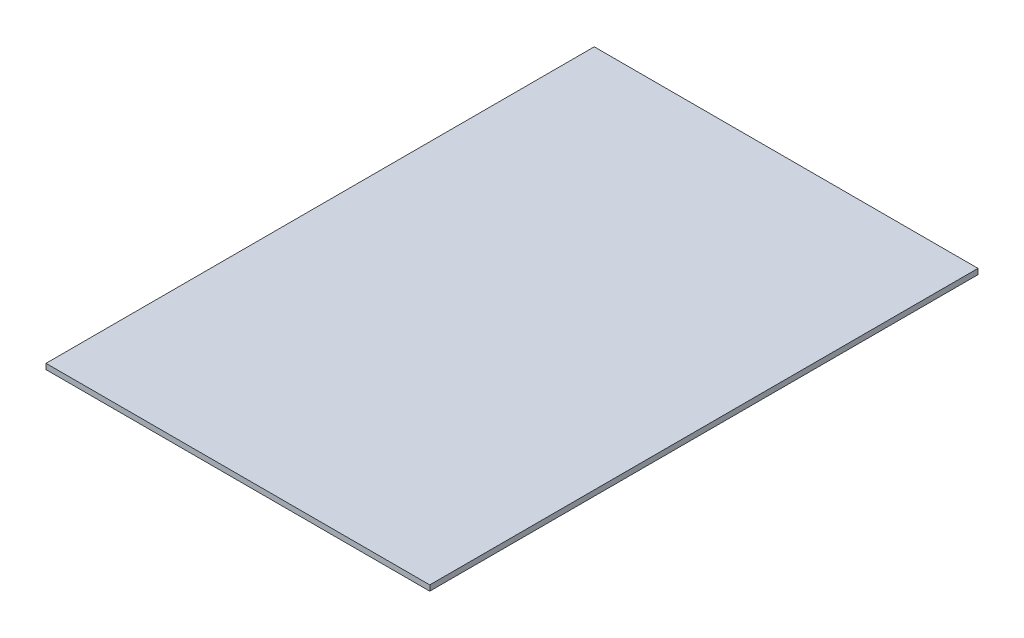
from build123d import *

# Parameters (mm, degrees)
SKETCH1_W           = 3500
SKETCH1_H           = 5000
BOSS_EXTRUDE1_DEPTH = 50
SKETCH2_W           = 750
SKETCH2_H           = 750
CUT_EXTRUDE1_DEPTH  = 10
SKETCH3_W           = 750
SKETCH3_H           = 750
CUT_EXTRUDE2_DEPTH  = 10


with BuildPart() as part:
    # Sketch1 → Boss-Extrude1 (new body)
    with BuildSketch(Plane(origin=(0, 0, 0), x_dir=(1, 0, 0), z_dir=(0, 1, 0))):
        Rectangle(SKETCH1_W, SKETCH1_H)
    extrude(amount=BOSS_EXTRUDE1_DEPTH)

    # Sketch2 → Cut-Extrude1 (cut)
    with BuildSketch(Plane.XZ):
        with Locations((-862.5, 1500)):
            Rectangle(SKETCH2_W, SKETCH2_H)
        with Locations((862.5, 1500)):
            Rectangle(SKETCH2_W, SKETCH2_H)
    extrude(amount=-CUT_EXTRUDE1_DEPTH, mode=Mode.SUBTRACT)

    # Sketch3 → Cut-Extrude2 (cut)
    with BuildSketch(Plane.XZ):
        with Locations((0, -1500)):
            Rectangle(SKETCH3_W, SKETCH3_H)
    extrude(amount=-CUT_EXTRUDE2_DEPTH, mode=Mode.SUBTRACT)


solid = part.part
